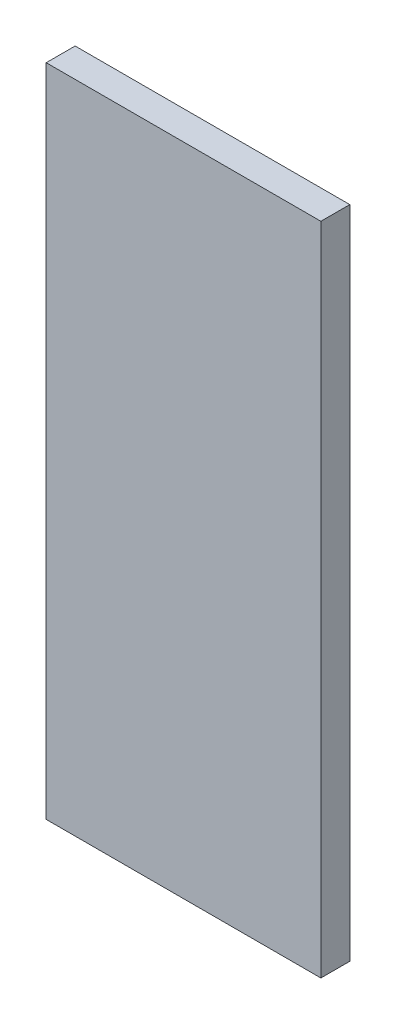
from build123d import *

# Parameters (mm, degrees)
SKETCH1_W           = 723.9
SKETCH1_H           = 1727.2
BOSS_EXTRUDE1_DEPTH = 76.2


with BuildPart() as part:
    # Sketch1 → Boss-Extrude1 (new body)
    with BuildSketch(Plane.XY):
        Rectangle(SKETCH1_W, SKETCH1_H)
    extrude(amount=BOSS_EXTRUDE1_DEPTH)


solid = part.part
